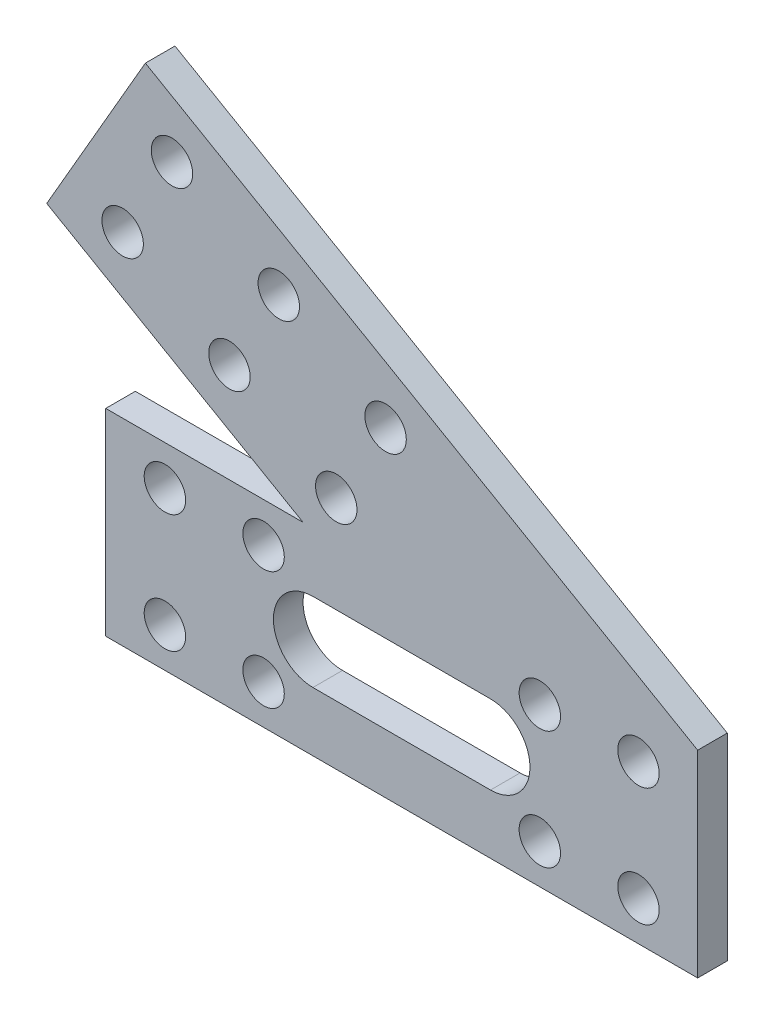
from build123d import *

# Parameters (mm, degrees)
EXTRUDE_1_DEPTH     = 3
SKETCH_2_R          = 2.1
CUT_EXTRUDE_1_DEPTH = 10


with BuildPart() as part:
    # 草图1 → 凸台-拉伸1 (new body)
    with BuildSketch(Plane.XY):
        Polygon((60, 0), (0, 0), (0, 20), (20, 20), (-5.980762114, 35), (4.019237886, 52.320508076), (60, 20), align=None)
    extrude(amount=EXTRUDE_1_DEPTH)

    # 草图2 → 切除-拉伸1 (cut)
    with BuildSketch(Plane.XY.offset(3)):
        with Locations((6.715390309, 44.990381057)):
            Circle(SKETCH_2_R)
        with Locations((1.715390309, 36.330127019)):
            Circle(SKETCH_2_R)
        with Locations((17.540707856, 38.740381057)):
            Circle(SKETCH_2_R)
        with Locations((12.540707856, 30.080127019)):
            Circle(SKETCH_2_R)
        with Locations((23.366025404, 23.830127019)):
            Circle(SKETCH_2_R)
        with Locations((28.366025404, 32.490381057)):
            Circle(SKETCH_2_R)
        with Locations((6, 16)):
            Circle(SKETCH_2_R)
        with Locations((6, 4)):
            Circle(SKETCH_2_R)
        with Locations((54, 16)):
            Circle(SKETCH_2_R)
        with Locations((54, 4)):
            Circle(SKETCH_2_R)
        with Locations((16, 16)):
            Circle(SKETCH_2_R)
        with Locations((16, 4)):
            Circle(SKETCH_2_R)
        with Locations((44, 16)):
            Circle(SKETCH_2_R)
        with Locations((44, 4)):
            Circle(SKETCH_2_R)
        with BuildLine():
            Line((21, 14), (39, 14))
            ThreePointArc((39, 14), (43, 10), (39, 6))
            Line((39, 6), (21, 6))
            ThreePointArc((21, 6), (17, 10), (21, 14))
        make_face()
    extrude(amount=-CUT_EXTRUDE_1_DEPTH, mode=Mode.SUBTRACT)


solid = part.part
